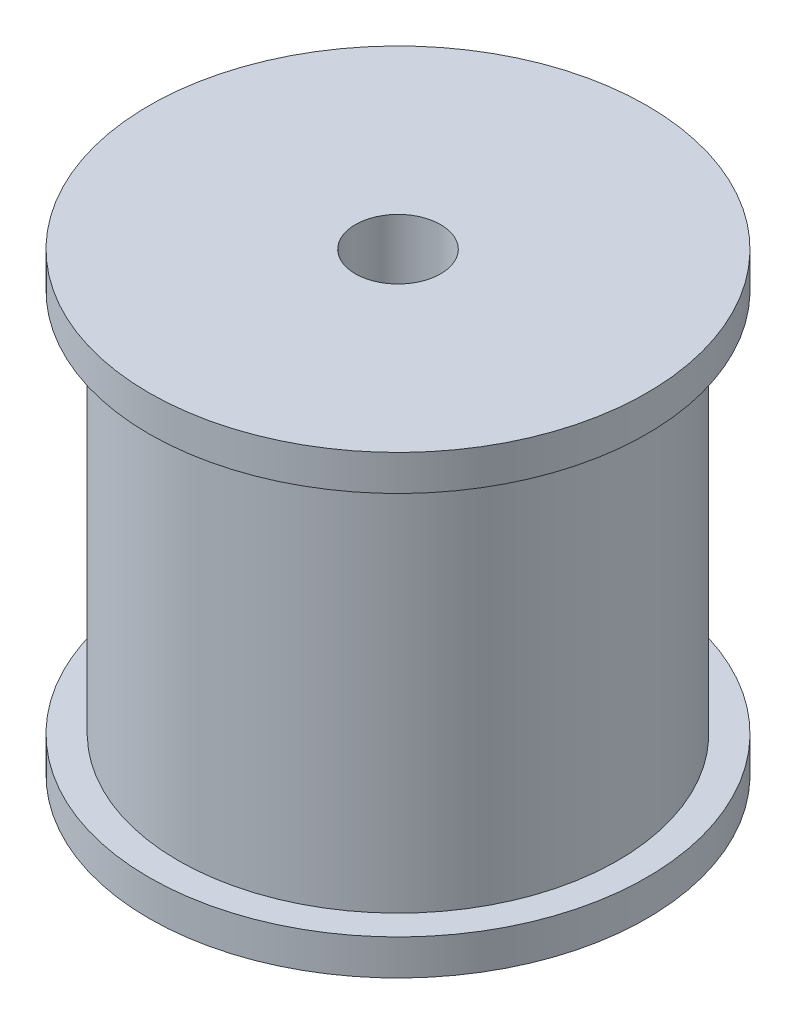
from build123d import *

# Parameters (mm, degrees)
SKETCH_1_R          = 15.45
EXTRUDE_1_DEPTH     = 13.5
SKETCH_2_R          = 17.5
EXTRUDE_2_DEPTH     = 2.5
EXTRUDE_START       = 2.5
SKETCH_3_R          = 17.5
EXTRUDE_3_DEPTH     = 2.5
SKETCH_4_R          = 3
CUT_EXTRUDE_1_DEPTH = 41.453677212


with BuildPart() as part:
    # 草图1 → 凸台-拉伸1 (new, symmetric)
    with BuildSketch(Plane(origin=(0, 0, 0), x_dir=(1, 0, 0), z_dir=(0, 1, 0))):
        with Locations(Location((0, 0, 0), (0, 0, 270))):
            Circle(SKETCH_1_R)
    extrude(amount=EXTRUDE_1_DEPTH, both=True)

    # 草图2 → 凸台-拉伸2 (add)
    with BuildSketch(Plane(origin=(0, 13.5, 0), x_dir=(1, 0, 0), z_dir=(0, 1, 0))):
        with Locations(Location((0, 0, 0), (0, 0, 270))):
            Circle(SKETCH_2_R)
    extrude(amount=EXTRUDE_2_DEPTH)

    # 草图3 → 凸台-拉伸3 (add)
    with BuildSketch(Plane.XZ.offset(13.5).offset(EXTRUDE_START)):
        with Locations(Location((0, 0, 0), (0, 0, 90))):
            Circle(SKETCH_3_R)
    extrude(amount=-EXTRUDE_3_DEPTH)

    # 草图4 → 切除-拉伸1 (cut, through all)
    with BuildSketch(Plane(origin=(0, 16, 0), x_dir=(1, 0, 0), z_dir=(0, 1, 0))):
        with Locations(Location((0, 0, 0), (0, 0, 270))):
            Circle(SKETCH_4_R)
    extrude(amount=-CUT_EXTRUDE_1_DEPTH, mode=Mode.SUBTRACT)


solid = part.part
